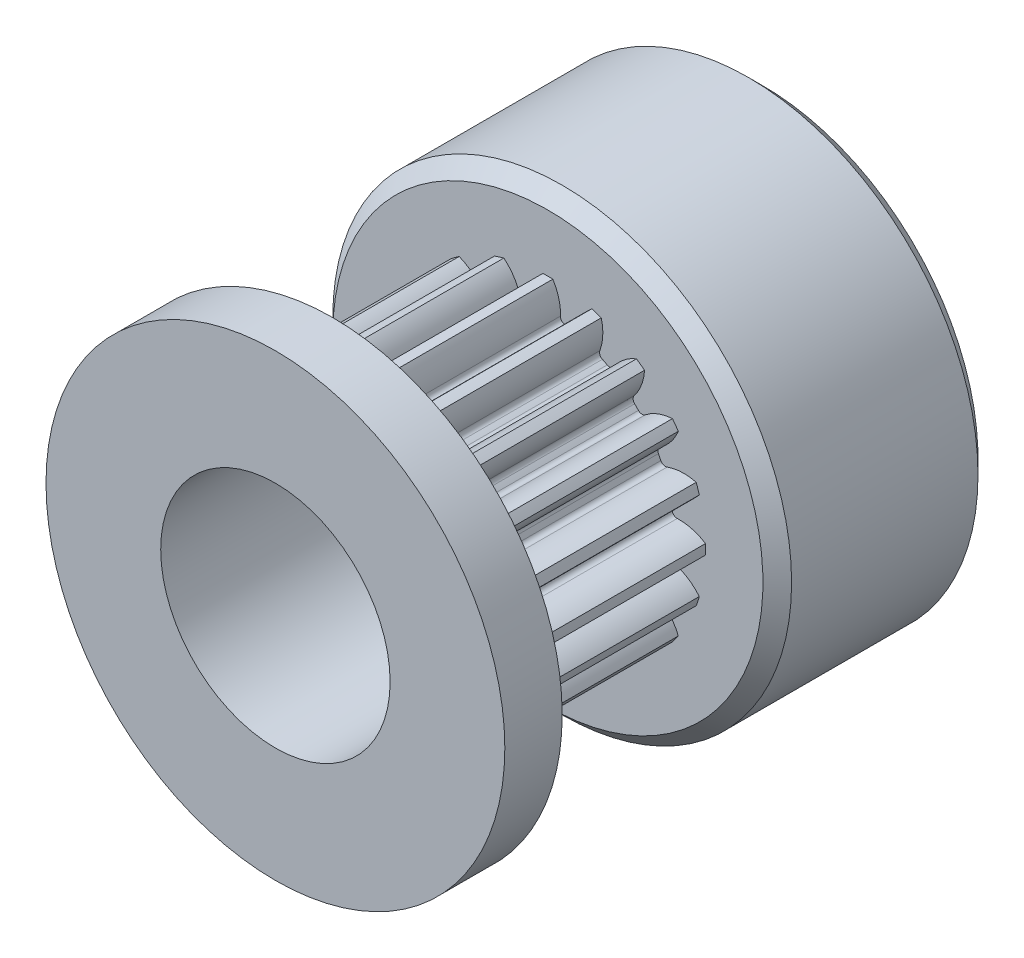
from build123d import *

# Parameters (mm, degrees)
ESQUISSE1_R                        = 1.15
BASE_EXTRUSION_DEPTH               = 2.5
BOSS_EXTRU_1_DEPTH                 = 7.5
CONG_1_R                           = 0.175
R_P_TITION_CIRCULAIRE4_COUNT       = 20
CONG_1_OF_R_P_TITION_CIRCULAIRE4_R = 0.175
SKETCH2_R                          = 8
BOSS_EXTRUDE1_DEPTH                = 2
BOSS_EXTRUDE2_START                = 7.5
SKETCH3_R                          = 8
BOSS_EXTRUDE2_DEPTH                = 7.5
SKETCH4_R                          = 4
CUT_EXTRUDE1_DEPTH                 = 21.420577935
CHAMFER1_SIZE                      = 0.5
SKETCH6_R                          = 2
CUT_EXTRUDE2_DEPTH                 = 15.773286811
SKETCH7_R                          = 2
CUT_EXTRUDE3_DEPTH                 = 15.773286876


with BuildPart() as part:
    # Esquisse1 → Base-Extrusion (new body)
    with BuildSketch(Plane.XY):
        Circle(ESQUISSE1_R)
    extrude(amount=BASE_EXTRUSION_DEPTH)

    # Esquisse3 → Boss.-Extru.1 (add)
    with BuildSketch(Plane.XY):
        with BuildLine():
            Line((-0.684400785, 4.32113649), (0, 0))
            Line((0, 0), (0.684400785, 4.32113649))
            ThreePointArc((0.684400785, 4.32113649), (0.555829687, 4.339548175), (0.426768711, 4.354135215))
            ThreePointArc((0.426768711, 4.354135215), (0.400825052, 4.947966893), (0.173691112, 5.497256716))
            ThreePointArc((0.173691112, 5.497256716), (0, 5.5), (-0.173691112, 5.497256716))
            ThreePointArc((-0.173691112, 5.497256716), (-0.400825052, 4.947966893), (-0.426768711, 4.354135215))
            ThreePointArc((-0.426768711, 4.354135215), (-0.555829687, 4.339548175), (-0.684400785, 4.32113649))
        make_face()
    boss_extru_1 = extrude(amount=BOSS_EXTRU_1_DEPTH)

    # Congé1
    cong_1_edges = [part.edges().sort_by_distance(p)[0] for p in [
        (0.426768711, 4.354135215, 3.75),
        (-0.426768711, 4.354135215, 3.75),
    ]]
    fillet(cong_1_edges, radius=CONG_1_R)

    # Répétition circulaire4: Boss.-Extru.1 ×20 about axis
    r_p_tition_circulaire4_axis = Axis((0, 0, 57.5), (0, 0, -1))
    for i in range(1, R_P_TITION_CIRCULAIRE4_COUNT):
        add(boss_extru_1.rotate(r_p_tition_circulaire4_axis, i * 360 / R_P_TITION_CIRCULAIRE4_COUNT))

    # Congé1 of Répétition circulaire4
    cong_1_of_r_p_tition_circulaire4_edges = [part.edges().sort_by_distance(p)[0] for p in [
        (1.751382941, 4.009149884, 3.75),
        (0.939620613, 4.272907453, 3.75),
        (2.904559606, 3.27172103, 3.75),
        (2.214033326, 3.773417739, 3.75),
        (3.773417739, 2.214033326, 3.75),
        (3.27172103, 2.904559606, 3.75),
        (4.272907453, 0.939620613, 3.75),
        (4.009149884, 1.751382941, 3.75),
        (4.354135215, -0.426768711, 3.75),
        (4.354135215, 0.426768711, 3.75),
        (4.009149884, -1.751382941, 3.75),
        (4.272907453, -0.939620613, 3.75),
        (3.27172103, -2.904559606, 3.75),
        (3.773417739, -2.214033326, 3.75),
        (2.214033326, -3.773417739, 3.75),
        (2.904559606, -3.27172103, 3.75),
        (0.939620613, -4.272907453, 3.75),
        (1.751382941, -4.009149884, 3.75),
        (-0.426768711, -4.354135215, 3.75),
        (0.426768711, -4.354135215, 3.75),
        (-1.751382941, -4.009149884, 3.75),
        (-0.939620613, -4.272907453, 3.75),
        (-2.904559606, -3.27172103, 3.75),
        (-2.214033326, -3.773417739, 3.75),
        (-3.773417739, -2.214033326, 3.75),
        (-3.27172103, -2.904559606, 3.75),
        (-4.272907453, -0.939620613, 3.75),
        (-4.009149884, -1.751382941, 3.75),
        (-4.354135215, 0.426768711, 3.75),
        (-4.354135215, -0.426768711, 3.75),
        (-4.009149884, 1.751382941, 3.75),
        (-4.272907453, 0.939620613, 3.75),
        (-3.27172103, 2.904559606, 3.75),
        (-3.773417739, 2.214033326, 3.75),
        (-2.214033326, 3.773417739, 3.75),
        (-2.904559606, 3.27172103, 3.75),
        (-0.939620613, 4.272907453, 3.75),
        (-1.751382941, 4.009149884, 3.75),
    ]]
    fillet(cong_1_of_r_p_tition_circulaire4_edges, radius=CONG_1_OF_R_P_TITION_CIRCULAIRE4_R)

    # Sketch2 → Boss-Extrude1 (add)
    with BuildSketch(Plane.XY.offset(7.5)):
        Circle(SKETCH2_R)
    extrude(amount=BOSS_EXTRUDE1_DEPTH)

    # Sketch3 → Boss-Extrude2 (add)
    with BuildSketch(Plane(origin=(0, 0, 0), x_dir=(-1, 0, 0), z_dir=(0, 0, -1)).offset(BOSS_EXTRUDE2_START)):
        Circle(SKETCH3_R)
    extrude(amount=-BOSS_EXTRUDE2_DEPTH)

    # Sketch4 → Cut-Extrude1 (cut, through all)
    with BuildSketch(Plane(origin=(0, 0, -7.5), x_dir=(-1, 0, 0), z_dir=(0, 0, -1))):
        Circle(SKETCH4_R)
    extrude(amount=-CUT_EXTRUDE1_DEPTH, mode=Mode.SUBTRACT)

    # Chamfer1
    chamfer1_edges = [part.edges().sort_by_distance(p)[0] for p in [
        (8, 0, 0),
        (8, 0, -7.5),
    ]]
    chamfer(chamfer1_edges, length=CHAMFER1_SIZE)

    # Sketch6 → Cut-Extrude2 (cut, through all)
    with BuildSketch(Plane(origin=(0, 0, 0), x_dir=(1, 0, 0), z_dir=(0, 1, 0))):
        with Locations((0, 3.75)):
            Circle(SKETCH6_R)
    extrude(amount=-CUT_EXTRUDE2_DEPTH, mode=Mode.SUBTRACT)

    # Sketch7 → Cut-Extrude3 (cut, through all)
    with BuildSketch(Plane(origin=(0, 0, 0), x_dir=(0, 0, -1), z_dir=(1, 0, 0))):
        with Locations((3.75, 0)):
            Circle(SKETCH7_R)
    extrude(amount=-CUT_EXTRUDE3_DEPTH, mode=Mode.SUBTRACT)


solid = part.part
